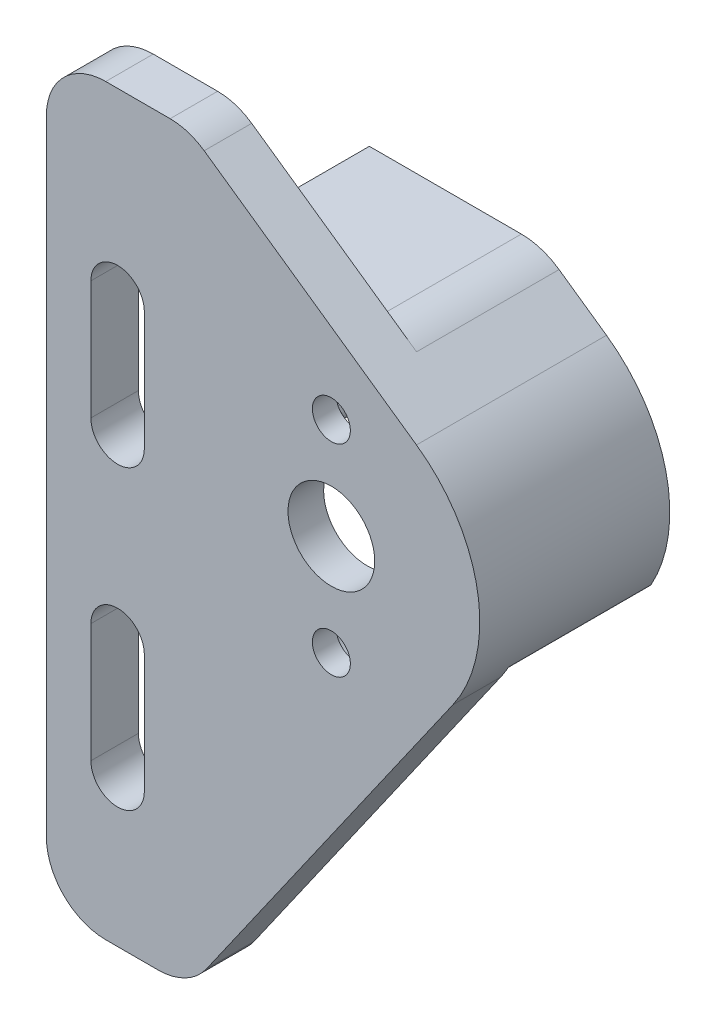
from build123d import *

# Parameters (mm, degrees)
SKETCH1_R           = 3.65
SKETCH1_R_2         = 1.6
BOSS_EXTRUDE1_DEPTH = 2
SKETCH2_R           = 3
CUT_EXTRUDE1_DEPTH  = 2
SKETCH3_R           = 6
CUT_EXTRUDE2_DEPTH  = 1
FILLET1_R           = 1
BOSS_EXTRUDE2_DEPTH = 12


with BuildPart() as part:
    # Sketch1 → Boss-Extrude1 (new, symmetric)
    with BuildSketch(Plane.XY):
        with BuildLine():
            Line((-24, 18.662172818), (-24, -33.930861026))
            ThreePointArc((-24, -33.930861026), (-22.535533906, -37.466394932), (-19, -38.930861026))
            Line((-19, -38.930861026), (-14.602835253, -38.930861026))
            ThreePointArc((-14.602835253, -38.930861026), (-12.294092187, -38.365915192), (-10.507075031, -36.798743208))
            Line((-10.507075031, -36.798743208), (10.239400554, -7.169705454))
            ThreePointArc((10.239400554, -7.169705454), (12.310096913, 2.170602221), (7.169705454, 10.239400554))
            Line((7.169705454, 10.239400554), (-10.708611763, 22.757933039))
            ThreePointArc((-10.708611763, 22.757933039), (-12.072964947, 23.430757572), (-13.576493944, 23.662172818))
            Line((-13.576493944, 23.662172818), (-19, 23.662172818))
            ThreePointArc((-19, 23.662172818), (-22.535533906, 22.197706724), (-24, 18.662172818))
        make_face()
        Circle(SKETCH1_R, mode=Mode.SUBTRACT)
        with Locations((0, 8.5)):
            Circle(SKETCH1_R_2, mode=Mode.SUBTRACT)
        with Locations((0, -8.5)):
            Circle(SKETCH1_R_2, mode=Mode.SUBTRACT)
        with BuildLine():
            Line((-15.75, 8.5), (-15.75, -1.5))
            ThreePointArc((-15.75, -1.5), (-18, -3.75), (-20.25, -1.5))
            Line((-20.25, -1.5), (-20.25, 8.5))
            ThreePointArc((-20.25, 8.5), (-18, 10.75), (-15.75, 8.5))
        make_face(mode=Mode.SUBTRACT)
        with BuildLine():
            Line((-15.75, -16.5), (-15.75, -26.5))
            ThreePointArc((-15.75, -26.5), (-18, -28.75), (-20.25, -26.5))
            Line((-20.25, -26.5), (-20.25, -16.5))
            ThreePointArc((-20.25, -16.5), (-18, -14.25), (-15.75, -16.5))
        make_face(mode=Mode.SUBTRACT)
    extrude(amount=BOSS_EXTRUDE1_DEPTH, both=True)

    # Sketch2 → Cut-Extrude1 (cut)
    with BuildSketch(Plane(origin=(0, 0, -2), x_dir=(-1, 0, 0), z_dir=(0, 0, -1))):
        with Locations((0, 8.5)):
            Circle(SKETCH2_R)
        with Locations((0, -8.5)):
            Circle(SKETCH2_R)
    extrude(amount=-CUT_EXTRUDE1_DEPTH, mode=Mode.SUBTRACT)

    # Sketch3 → Cut-Extrude2 (cut)
    with BuildSketch(Plane(origin=(0, 0, -2), x_dir=(-1, 0, 0), z_dir=(0, 0, -1))):
        Circle(SKETCH3_R)
    extrude(amount=-CUT_EXTRUDE2_DEPTH, mode=Mode.SUBTRACT)

    # Fillet1
    fillet1_edges = [part.edges().sort_by_distance(p)[0] for p in [
        (-1.383838376, -5.838235294, -1.5),
        (1.383838376, -5.838235294, -1.5),
        (-1.383838376, 5.838235294, -1.5),
        (1.383838376, 5.838235294, -1.5),
    ]]
    fillet(fillet1_edges, radius=FILLET1_R)

    # Sketch4 → Boss-Extrude2 (add)
    with BuildSketch(Plane(origin=(0, 0, -2), x_dir=(-1, 0, 0), z_dir=(0, 0, -1))):
        with BuildLine():
            Line((9.8, 7), (1.357173626, 11.217114259))
            ThreePointArc((1.357173626, 11.217114259), (-0.22398046, 11.528937586), (-1.742070725, 10.987934834))
            Line((-1.742070725, 10.987934834), (-5.735764364, 8.191520443))
            ThreePointArc((-5.735764364, 8.191520443), (-8.870108332, 4.617486132), (-10, 0))
            Line((-10, 0), (-10, -5.809475019))
            ThreePointArc((-10, -5.809475019), (-10.375, -6.293597938), (-10.9375, -6.051536478))
            ThreePointArc((-10.9375, -6.051536478), (-12.178521244, 2.8166683), (-7.169705454, 10.239400554))
            Line((-7.169705454, 10.239400554), (-3.176011816, 13.035814944))
            ThreePointArc((-3.176011816, 13.035814944), (-1.665070445, 13.78092877), (0, 14.037207624))
            Line((0, 14.037207624), (12.8, 14.037207624))
            Line((12.8, 14.037207624), (12.8, 7))
            Line((12.8, 7), (9.8, 7))
        make_face()
    extrude(amount=BOSS_EXTRUDE2_DEPTH)


solid = part.part
